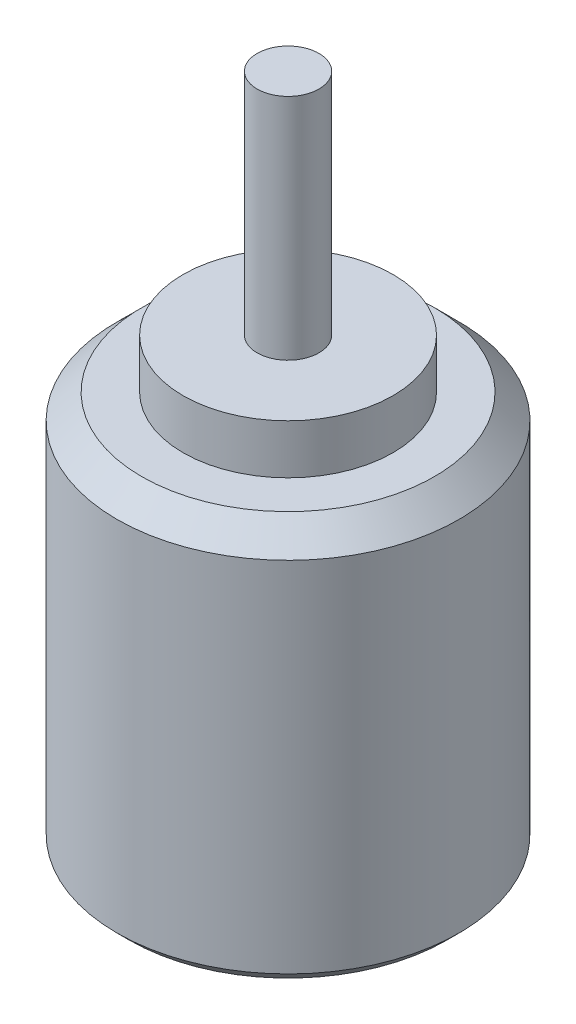
from build123d import *

# Parameters (mm, degrees)
SKETCH_1_R          = 13.85
EXTRUDE_1_DEPTH     = 32
SKETCH_2_R          = 2.5
EXTRUDE_2_DEPTH     = 2.5
SKETCH_3_R          = 8.5
EXTRUDE_3_DEPTH     = 4
EXTRUDE_START       = 18.5
SKETCH_4_R          = 2.5
EXTRUDE_4_DEPTH     = 18.5
CHAMFER_1_SIZE      = 2
CHAMFER_2_SIZE      = 1
SKETCH_5_R          = 1.35
CUT_EXTRUDE_1_DEPTH = 3


with BuildPart() as part:
    # 草图1 → 凸台-拉伸1 (new body)
    with BuildSketch(Plane(origin=(0, 0, 0), x_dir=(1, 0, 0), z_dir=(0, 1, 0))):
        with Locations(Location((0, 0, 0), (0, 0, 270))):
            Circle(SKETCH_1_R)
    extrude(amount=EXTRUDE_1_DEPTH)

    # 草图2 → 凸台-拉伸2 (add)
    with BuildSketch(Plane.XZ):
        with Locations(Location((0, 0, 0), (0, 0, 270))):
            Circle(SKETCH_2_R)
    extrude(amount=EXTRUDE_2_DEPTH)

    # 草图3 → 凸台-拉伸3 (add)
    with BuildSketch(Plane(origin=(0, 32, 0), x_dir=(1, 0, 0), z_dir=(0, 1, 0))):
        with Locations(Location((0, 0, 0), (0, 0, 270))):
            Circle(SKETCH_3_R)
    extrude(amount=EXTRUDE_3_DEPTH)

    # 草图4 → 凸台-拉伸4 (add)
    with BuildSketch(Plane(origin=(0, 36, 0), x_dir=(1, 0, 0), z_dir=(0, 1, 0)).offset(EXTRUDE_START)):
        with Locations(Location((0, 0, 0), (0, 0, 90))):
            Circle(SKETCH_4_R)
    extrude(amount=-EXTRUDE_4_DEPTH)

    # 倒角1
    chamfer_1_edges = [part.edges().sort_by_distance(p)[0] for p in [
        (0, 32, -13.85),
    ]]
    chamfer(chamfer_1_edges, length=CHAMFER_1_SIZE)

    # 倒角2
    chamfer_2_edges = [part.edges().sort_by_distance(p)[0] for p in [
        (0, 0, -13.85),
    ]]
    chamfer(chamfer_2_edges, length=CHAMFER_2_SIZE)

    # 草图5 → 切除-拉伸1 (cut)
    with BuildSketch(Plane.XZ):
        with Locations(Location((0, 8, 0), (0, 0, 270))):
            Circle(SKETCH_5_R)
        with Locations(Location((-9.5, 0, 0), (0, 0, 270))):
            Circle(SKETCH_5_R)
        with Locations(Location((0, -8, 0), (0, 0, 270))):
            Circle(SKETCH_5_R)
        with Locations(Location((9.5, 0, 0), (0, 0, 270))):
            Circle(SKETCH_5_R)
    extrude(amount=-CUT_EXTRUDE_1_DEPTH, mode=Mode.SUBTRACT)


solid = part.part
